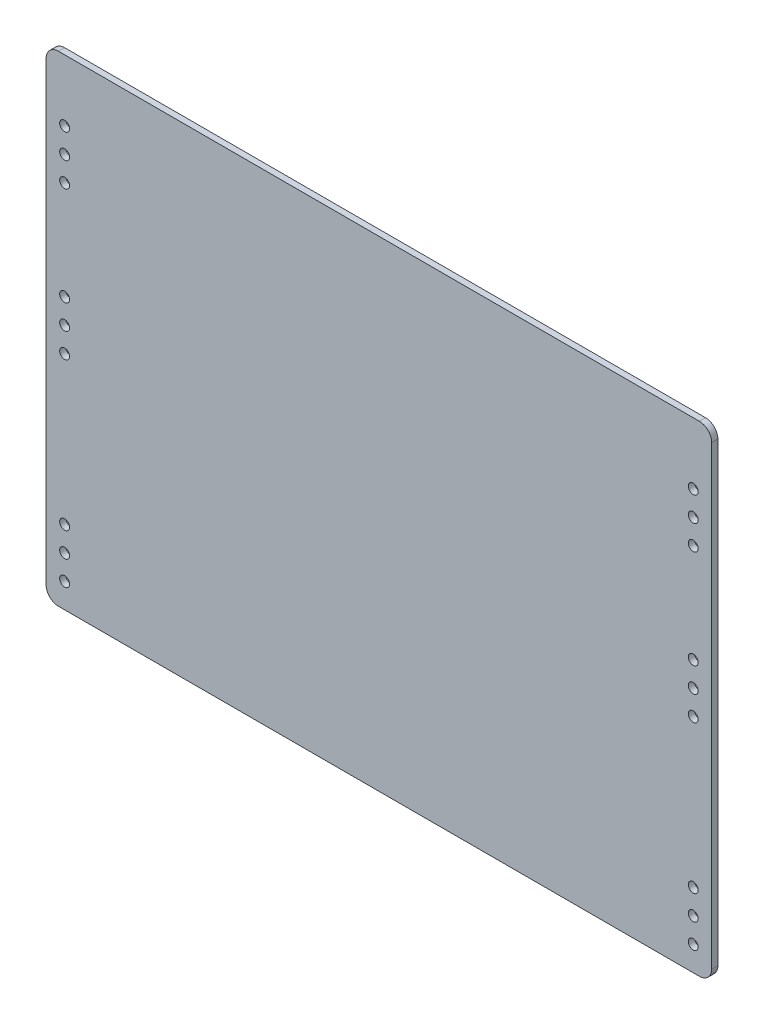
from build123d import *

# Parameters (mm, degrees)
SKETCH1_W           = 342.9
SKETCH1_H           = 247.65
SKETCH1_R           = 2.5527
BOSS_EXTRUDE1_DEPTH = 3.175
FILLET1_R           = 6.35


with BuildPart() as part:
    # Sketch1 → Boss-Extrude1 (new body)
    with BuildSketch(Plane.XY):
        with Locations((171.45, 123.825)):
            Rectangle(SKETCH1_W, SKETCH1_H)
        with Locations((9.525, 12.7)):
            Circle(SKETCH1_R, mode=Mode.SUBTRACT)
        with Locations((9.525, 25.4)):
            Circle(SKETCH1_R, mode=Mode.SUBTRACT)
        with Locations((9.525, 38.1)):
            Circle(SKETCH1_R, mode=Mode.SUBTRACT)
        with Locations((9.525, 114.3)):
            Circle(SKETCH1_R, mode=Mode.SUBTRACT)
        with Locations((9.525, 127)):
            Circle(SKETCH1_R, mode=Mode.SUBTRACT)
        with Locations((9.525, 139.7)):
            Circle(SKETCH1_R, mode=Mode.SUBTRACT)
        with Locations((9.525, 215.9)):
            Circle(SKETCH1_R, mode=Mode.SUBTRACT)
        with Locations((9.525, 203.2)):
            Circle(SKETCH1_R, mode=Mode.SUBTRACT)
        with Locations((9.525, 190.5)):
            Circle(SKETCH1_R, mode=Mode.SUBTRACT)
        with Locations(Location((333.375, 215.9, 0), (0, 0, 180))):
            Circle(SKETCH1_R, mode=Mode.SUBTRACT)
        with Locations(Location((333.375, 203.2, 0), (0, 0, 180))):
            Circle(SKETCH1_R, mode=Mode.SUBTRACT)
        with Locations(Location((333.375, 190.5, 0), (0, 0, 180))):
            Circle(SKETCH1_R, mode=Mode.SUBTRACT)
        with Locations(Location((333.375, 139.7, 0), (0, 0, 180))):
            Circle(SKETCH1_R, mode=Mode.SUBTRACT)
        with Locations(Location((333.375, 127, 0), (0, 0, 180))):
            Circle(SKETCH1_R, mode=Mode.SUBTRACT)
        with Locations(Location((333.375, 114.3, 0), (0, 0, 180))):
            Circle(SKETCH1_R, mode=Mode.SUBTRACT)
        with Locations(Location((333.375, 38.1, 0), (0, 0, 180))):
            Circle(SKETCH1_R, mode=Mode.SUBTRACT)
        with Locations(Location((333.375, 25.4, 0), (0, 0, 180))):
            Circle(SKETCH1_R, mode=Mode.SUBTRACT)
        with Locations(Location((333.375, 12.7, 0), (0, 0, 180))):
            Circle(SKETCH1_R, mode=Mode.SUBTRACT)
    extrude(amount=BOSS_EXTRUDE1_DEPTH)

    # Fillet1
    fillet1_edges = [part.edges().sort_by_distance(p)[0] for p in [
        (0, 247.65, 1.5875),
        (342.9, 247.65, 1.5875),
        (342.9, 0, 1.5875),
        (0, 0, 1.5875),
    ]]
    fillet(fillet1_edges, radius=FILLET1_R)


solid = part.part
